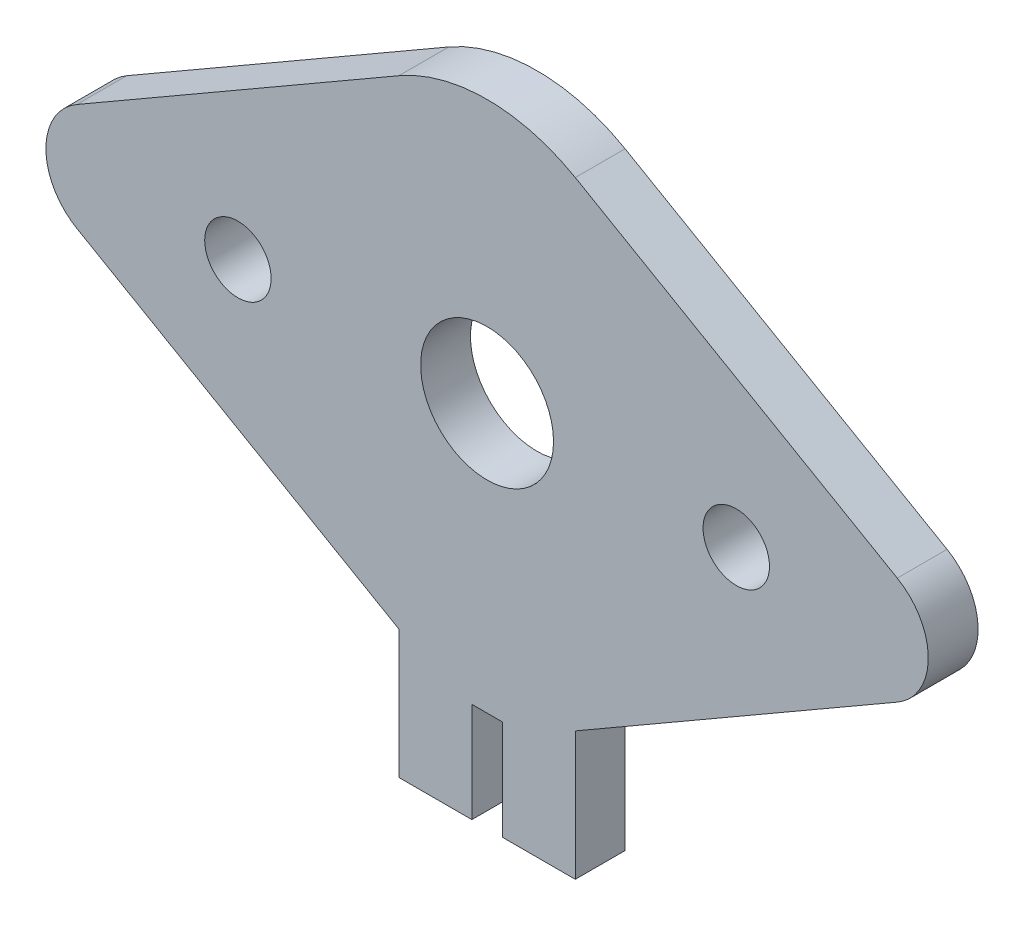
from build123d import *

# Parameters (mm, degrees)
SKETCH_1_R      = 4
SKETCH_1_R_2    = 2
EXTRUDE_1_DEPTH = 3


with BuildPart() as part:
    # 草图1 → 凸台-拉伸1 (new body)
    with BuildSketch(Plane.XY):
        with BuildLine():
            Line((5.309266756, 14.424138209), (24.693114579, 3.23286845))
            ThreePointArc((24.693114579, 3.23286845), (26.559612049, 0), (24.693114579, -3.23286845))
            Line((24.693114579, -3.23286845), (5.309266756, -14.424138209))
            Line((5.309266756, -14.424138209), (5.309266756, -22.162123177))
            Line((5.309266756, -22.162123177), (0.916263641, -22.162123177))
            Line((0.916263641, -22.162123177), (0.916263641, -16.150751559))
            Line((0.916263641, -16.150751559), (-0.916263641, -16.150751559))
            Line((-0.916263641, -16.150751559), (-0.916263641, -22.162123177))
            Line((-0.916263641, -22.162123177), (-5.309266756, -22.162123177))
            Line((-5.309266756, -22.162123177), (-5.309266756, -14.424138209))
            Line((-5.309266756, -14.424138209), (-24.693114579, -3.23286845))
            ThreePointArc((-24.693114579, -3.23286845), (-26.559612049, 0), (-24.693114579, 3.23286845))
            Line((-24.693114579, 3.23286845), (-5.309266756, 14.424138209))
            ThreePointArc((-5.309266756, 14.424138209), (0, 15.846751948), (5.309266756, 14.424138209))
        make_face()
        Circle(SKETCH_1_R, mode=Mode.SUBTRACT)
        with Locations((15, 0)):
            Circle(SKETCH_1_R_2, mode=Mode.SUBTRACT)
        with Locations(Location((-15, 0, 0), (0, 0, 180))):
            Circle(SKETCH_1_R_2, mode=Mode.SUBTRACT)
    extrude(amount=EXTRUDE_1_DEPTH)


solid = part.part
